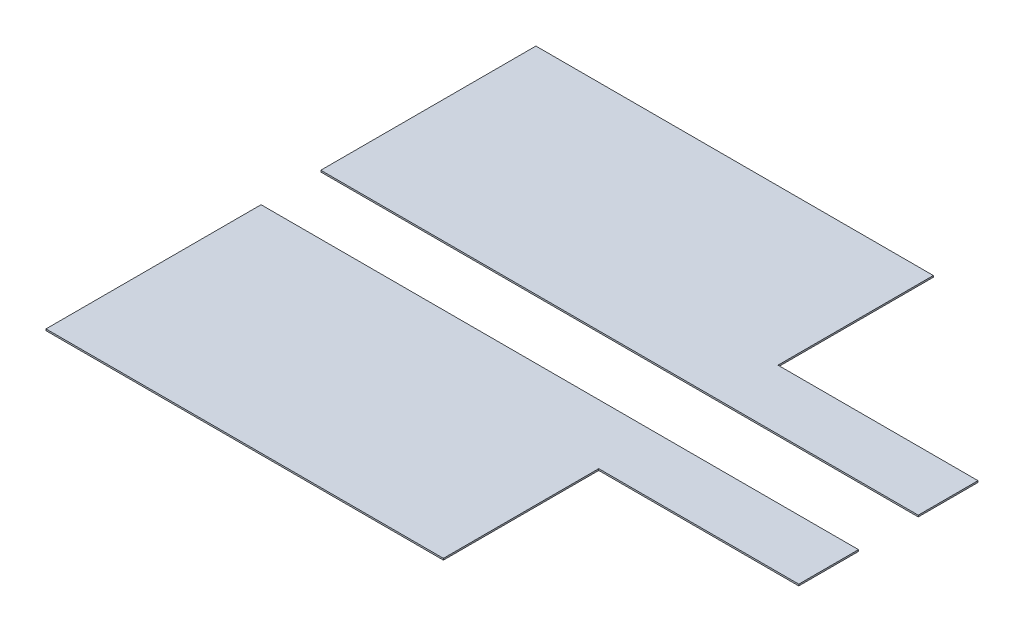
from build123d import *

# Parameters (mm, degrees)
BOSS_EXTRUDE1_DEPTH   = 0.0666
BOSS_EXTRUDE1_2_DEPTH = 0.0666


with BuildPart() as part:
    # Sketch1 → Boss-Extrude1 (new body)
    with BuildSketch(Plane(origin=(0, 0, 0), x_dir=(1, 0, 0), z_dir=(0, 1, 0))):
        Polygon((0, 1.25), (25, 1.25), (25, 3.75), (16.63, 3.75), (16.63, 10.25), (0, 10.25), align=None)
    extrude(amount=BOSS_EXTRUDE1_DEPTH)


with BuildPart() as body_2:
    # Sketch1 → Boss-Extrude1 2 (new body)
    with BuildSketch(Plane(origin=(0, 0, 0), x_dir=(1, 0, 0), z_dir=(0, 1, 0))):
        Polygon((0, -1.25), (25, -1.25), (25, -3.75), (16.63, -3.75), (16.63, -10.25), (0, -10.25), align=None)
    extrude(amount=BOSS_EXTRUDE1_2_DEPTH)


solid = Compound([part.part, body_2.part])
